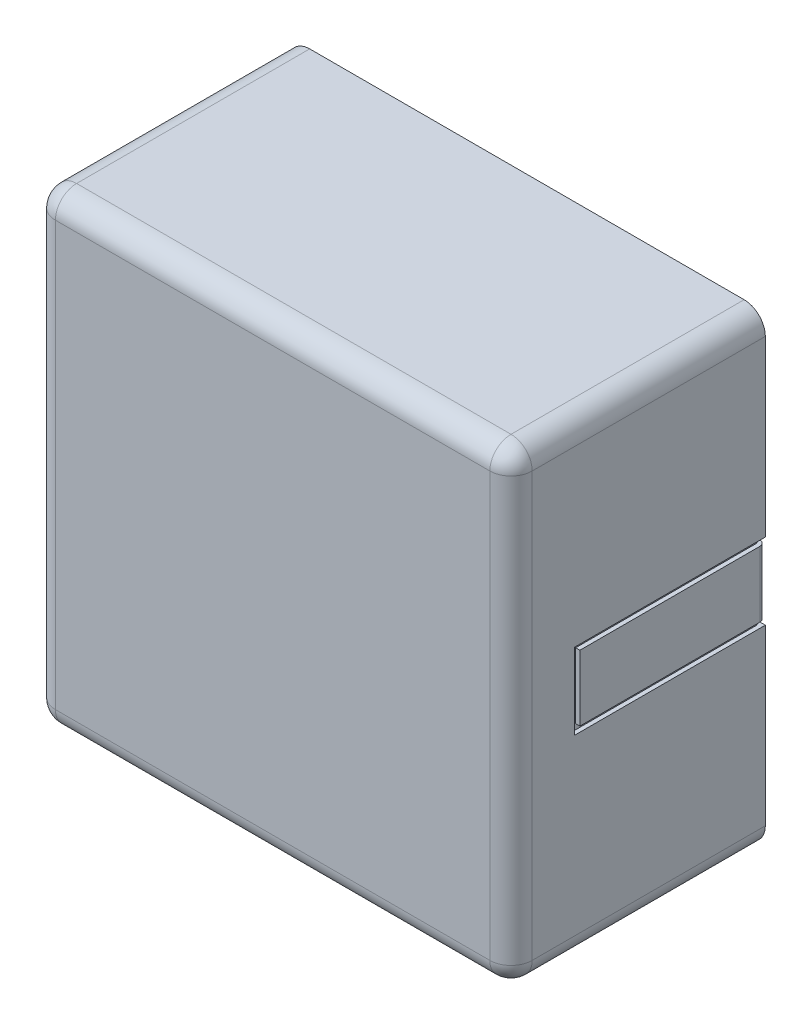
from build123d import *

# Parameters (mm, degrees)
SKETCH2_W           = 22.5
SKETCH2_H           = 22
BOSS_EXTRUDE1_DEPTH = 12
SKETCH3_W           = 5.55
SKETCH3_H           = 3.6
CUT_EXTRUDE1_DEPTH  = 0.2
SKETCH4_W           = 8.8
SKETCH4_H           = 3.6
CUT_EXTRUDE2_DEPTH  = 0.2
FILLET1_R           = 1
SKETCH5_W           = 5.3
SKETCH5_H           = 3.1
BOSS_EXTRUDE2_DEPTH = 8.75
FILLET2_R           = 0.25


with BuildPart() as part:
    # Sketch2 → Boss-Extrude1 (new body)
    with BuildSketch(Plane.XY):
        Rectangle(SKETCH2_W, SKETCH2_H)
    extrude(amount=BOSS_EXTRUDE1_DEPTH)

    # Sketch3 → Cut-Extrude1 (cut)
    with BuildSketch(Plane(origin=(0, 0, 0), x_dir=(-1, 0, 0), z_dir=(0, 0, -1))):
        with Locations((-8.475, 0)):
            Rectangle(SKETCH3_W, SKETCH3_H)
        with Locations((8.475, 0)):
            Rectangle(SKETCH3_W, SKETCH3_H)
    extrude(amount=-CUT_EXTRUDE1_DEPTH, mode=Mode.SUBTRACT)

    # Sketch4 → Cut-Extrude2 (cut)
    with BuildSketch(Plane(origin=(11.25, 0, 0), x_dir=(0, 0, -1), z_dir=(1, 0, 0))):
        with Locations((-4.6, 0)):
            Rectangle(SKETCH4_W, SKETCH4_H)
    cut_extrude2 = extrude(amount=-CUT_EXTRUDE2_DEPTH, mode=Mode.SUBTRACT)

    # Mirror1: Cut-Extrude2 across plane
    add(cut_extrude2.mirror(Plane(origin=(0, 0, 0), x_dir=(0, 0, 1), z_dir=(1, 0, 0))), mode=Mode.SUBTRACT)

    # Fillet1
    fillet1_edges = [part.edges().sort_by_distance(p)[0] for p in [
        (11.25, 0, 12),
        (0, 11, 12),
        (-11.25, 0, 12),
        (0, -11, 12),
        (-11.25, 11, 6),
        (11.25, 11, 6),
        (11.25, -11, 6),
        (-11.25, -11, 6),
    ]]
    fillet(fillet1_edges, radius=FILLET1_R)

    # Sketch5 → Boss-Extrude2 (add)
    with BuildSketch(Plane(origin=(0, 0, 0), x_dir=(-1, 0, 0), z_dir=(0, 0, -1))):
        with Locations((-8.6, 0)):
            Rectangle(SKETCH5_W, SKETCH5_H)
        with Locations((8.6, 0)):
            Rectangle(SKETCH5_W, SKETCH5_H)
    extrude(amount=-BOSS_EXTRUDE2_DEPTH)

    # Fillet2
    fillet2_edges = [part.edges().sort_by_distance(p)[0] for p in [
        (11.25, 0, 0),
        (-11.25, 0, 0),
    ]]
    fillet(fillet2_edges, radius=FILLET2_R)


solid = part.part
